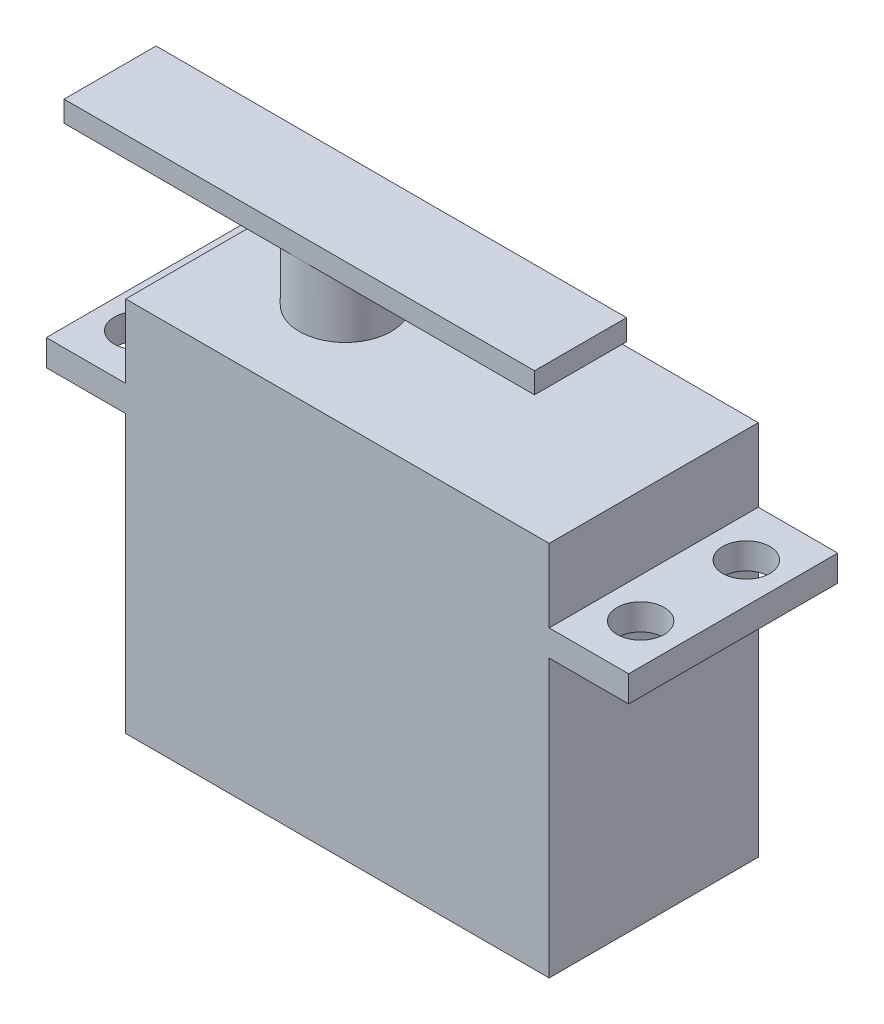
from build123d import *

# Parameters (mm, degrees)
SKETCH1_W           = 40.5
SKETCH1_H           = 36
BOSS_EXTRUDE1_DEPTH = 10
SKETCH2_W           = 55.7
SKETCH2_H           = 2.5
BOSS_EXTRUDE2_DEPTH = 20
SKETCH3_R           = 4.4
BOSS_EXTRUDE3_DEPTH = 8
SKETCH4_W           = 45
SKETCH4_H           = 8.8
BOSS_EXTRUDE4_DEPTH = 2
SKETCH5_R           = 2.25
CUT_EXTRUDE1_DEPTH  = 2.5


with BuildPart() as part:
    # Sketch1 → Boss-Extrude1 (new, symmetric)
    with BuildSketch(Plane.XY):
        Rectangle(SKETCH1_W, SKETCH1_H)
    extrude(amount=BOSS_EXTRUDE1_DEPTH, both=True)

    # Sketch2 → Boss-Extrude2 (add)
    with BuildSketch(Plane.XY.offset(10)):
        with Locations((0, 9.75)):
            Rectangle(SKETCH2_W, SKETCH2_H)
    extrude(amount=-BOSS_EXTRUDE2_DEPTH)

    # Sketch3 → Boss-Extrude3 (add)
    with BuildSketch(Plane(origin=(0, 18, 0), x_dir=(1, 0, 0), z_dir=(0, 1, 0))):
        with Locations(Location((-9.25, 0, 0), (0, 0, 90))):
            Circle(SKETCH3_R)
    extrude(amount=BOSS_EXTRUDE3_DEPTH)

    # Sketch4 → Boss-Extrude4 (add)
    with BuildSketch(Plane(origin=(0, 26, 0), x_dir=(1, 0, 0), z_dir=(0, 1, 0))):
        with Locations((-9.25, 0)):
            Rectangle(SKETCH4_W, SKETCH4_H)
    extrude(amount=-BOSS_EXTRUDE4_DEPTH)

    # Sketch5 → Cut-Extrude1 (cut)
    with BuildSketch(Plane.XZ.offset(-8.5)):
        with Locations(Location((-24.05, -5.05, 0), (0, 0, 270))):
            Circle(SKETCH5_R)
        with Locations(Location((-24.05, 5.05, 0), (0, 0, 270))):
            Circle(SKETCH5_R)
        with Locations(Location((24.05, -5.05, 0), (0, 0, 270))):
            Circle(SKETCH5_R)
        with Locations(Location((24.05, 5.05, 0), (0, 0, 270))):
            Circle(SKETCH5_R)
    extrude(amount=-CUT_EXTRUDE1_DEPTH, mode=Mode.SUBTRACT)


solid = part.part
